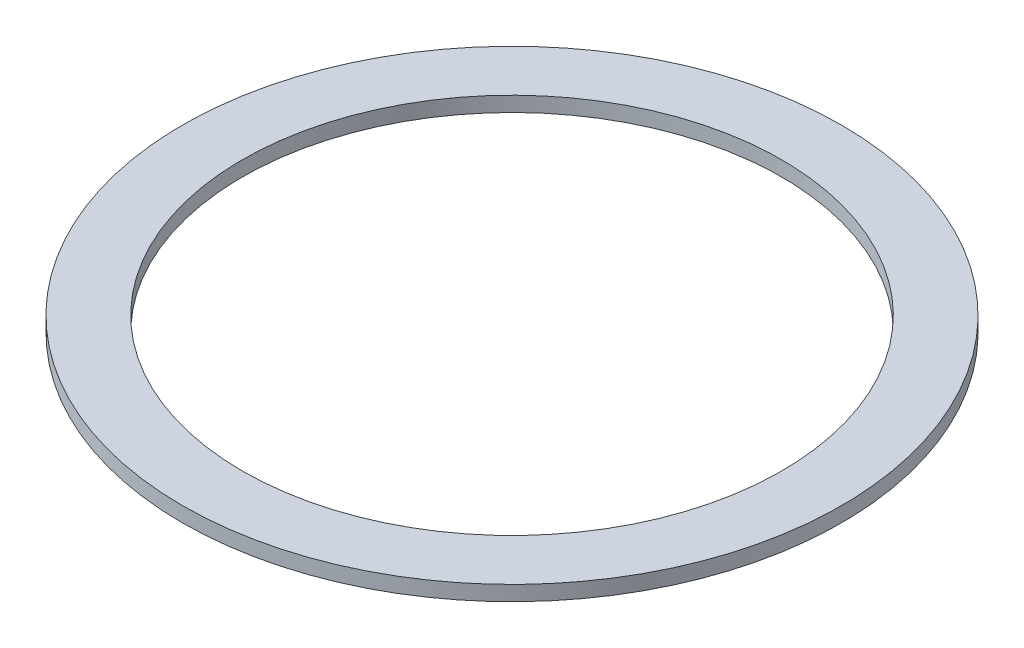
from build123d import *

# Parameters (mm, degrees)
SKETCH1_R           = 69.85
SKETCH1_R_2         = 57.15
BOSS_EXTRUDE1_DEPTH = 3.175


with BuildPart() as part:
    # Sketch1 → Boss-Extrude1 (new body)
    with BuildSketch(Plane(origin=(0, 0, 0), x_dir=(1, 0, 0), z_dir=(0, 1, 0))):
        with Locations(Location((0, 0, 0), (0, 0, 270))):
            Circle(SKETCH1_R)
        with Locations(Location((0, 0, 0), (0, 0, 270))):
            Circle(SKETCH1_R_2, mode=Mode.SUBTRACT)
    extrude(amount=BOSS_EXTRUDE1_DEPTH)


solid = part.part
